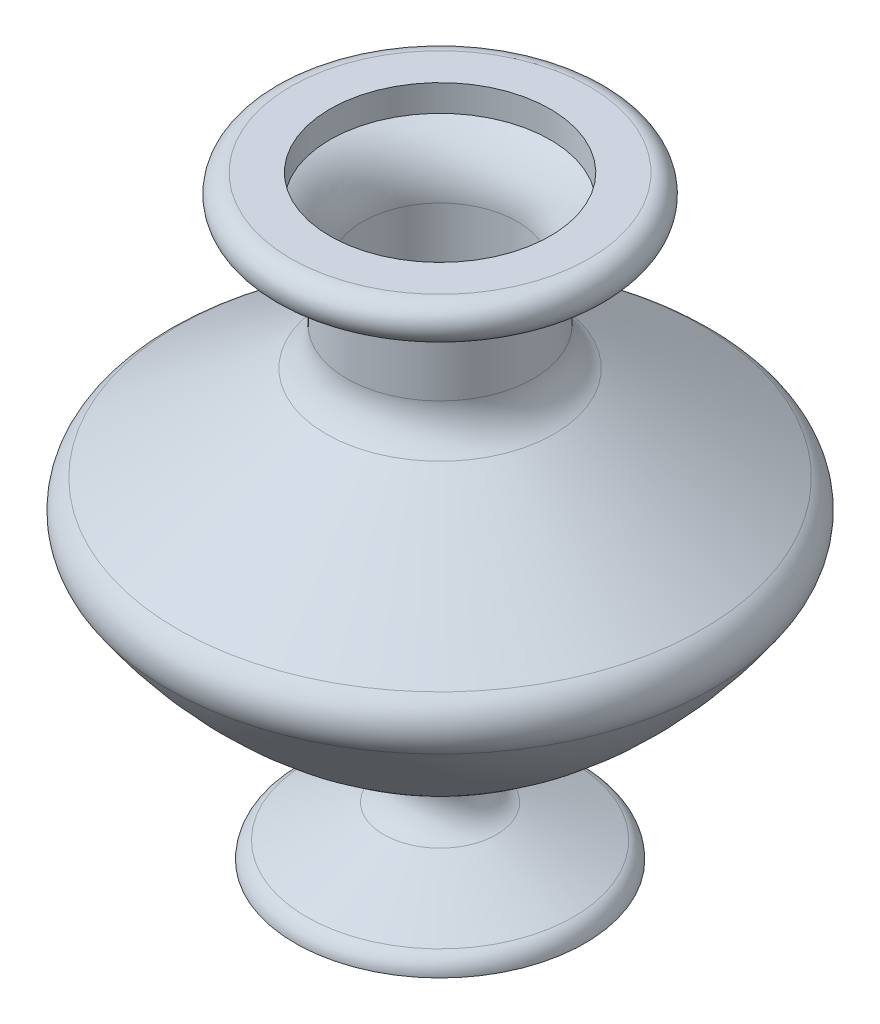
from build123d import *


with BuildPart() as part:
    # Sketch1 → Revolve1 (revolve)
    with BuildSketch(Plane.XY):
        with BuildLine():
            Line((0, -80), (-38.905140273, -80))
            ThreePointArc((-38.905140273, -80), (-38.078852669, -77.231326381), (-35.858836089, -75.382047821))
            Line((-35.858836089, -75.382047821), (-15.133390415, -66.584531189))
            ThreePointArc((-15.133390415, -66.584531189), (-9.650869177, -58.174922289), (-15.364995513, -49.92093409))
            ThreePointArc((-15.364995513, -49.92093409), (-47.791702716, -31.170183188), (-73.19366984, -3.641615015))
            ThreePointArc((-73.19366984, -3.641615015), (-74.55123305, 3.225570926), (-70.577400065, 8.988371636))
            Line((-70.577400065, 8.988371636), (-30.651460745, 34.448970621))
            ThreePointArc((-30.651460745, 34.448970621), (-26.581552186, 38.797273876), (-25.103556483, 44.566799469))
            Line((-25.103556483, 44.566799469), (-25.103556483, 58.266799469))
            ThreePointArc((-25.103556483, 58.266799469), (-29.403289108, 67.470379335), (-39.221203541, 70.078470432))
            ThreePointArc((-39.221203541, 70.078470432), (-45.083900238, 74.55708231), (-40.103556483, 80))
            Line((-40.103556483, 80), (-29.603556483, 80))
            Line((-29.603556483, 80), (-29.603556483, 72.851380368))
            ThreePointArc((-29.603556483, 72.851380368), (-23.104270786, 66.809632723), (-20.703556483, 58.266799469))
            Line((-20.703556483, 58.266799469), (-20.703556483, 44.566799469))
            ThreePointArc((-20.703556483, 44.566799469), (-22.723483943, 36.681781158), (-28.285692308, 30.739100044))
            Line((-28.285692308, 30.739100044), (-68.211631628, 5.278501058))
            ThreePointArc((-68.211631628, 5.278501058), (-70.24270182, 2.333069584), (-69.54883618, -1.176825452))
            ThreePointArc((-69.54883618, -1.176825452), (-45.04245123, -27.734835131), (-13.75899332, -45.824501868))
            ThreePointArc((-13.75899332, -45.824501868), (-5.251294108, -58.113773186), (-13.414159062, -70.634746437))
            Line((-13.414159062, -70.634746437), (-24.440030309, -75.314997333))
            ThreePointArc((-24.440030309, -75.314997333), (-24.535220148, -75.442913451), (-24.507880522, -75.6))
            Line((-24.507880522, -75.6), (0, -75.6))
            Line((0, -75.6), (0, -80))
        make_face()
    revolve(axis=Axis((0, 80, 0), (0, -1, 0)))


solid = part.part
